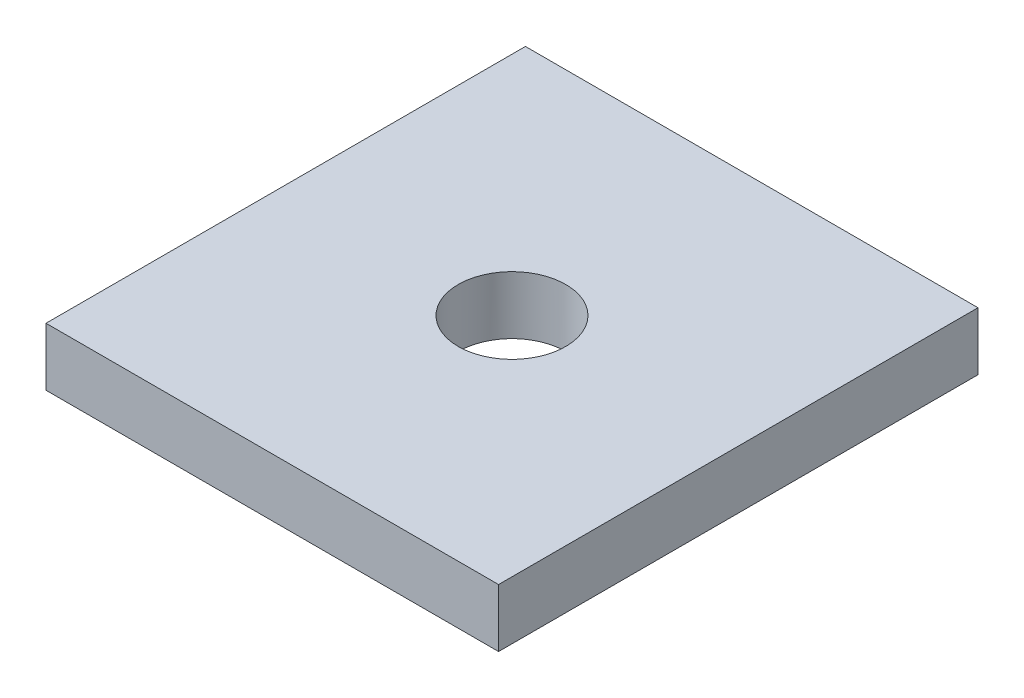
from build123d import *

# Parameters (mm, degrees)
SKETCH1_W           = 53.467
SKETCH1_H           = 56.642
BOSS_EXTRUDE2_DEPTH = 6.858
SKETCH2_R           = 6.35
CUT_EXTRUDE1_DEPTH  = 25.4


with BuildPart() as part:
    # Sketch1 → Boss-Extrude2 (new body)
    with BuildSketch(Plane(origin=(0, 0, 0), x_dir=(1, 0, 0), z_dir=(0, 1, 0))):
        Rectangle(SKETCH1_W, SKETCH1_H)
    extrude(amount=BOSS_EXTRUDE2_DEPTH)

    # Sketch2 → Cut-Extrude1 (cut)
    with BuildSketch(Plane(origin=(0, 6.858, 0), x_dir=(1, 0, 0), z_dir=(0, 1, 0))):
        with Locations(Location((0, 0, 0), (0, 0, 270))):
            Circle(SKETCH2_R)
    extrude(amount=-CUT_EXTRUDE1_DEPTH, mode=Mode.SUBTRACT)


solid = part.part
